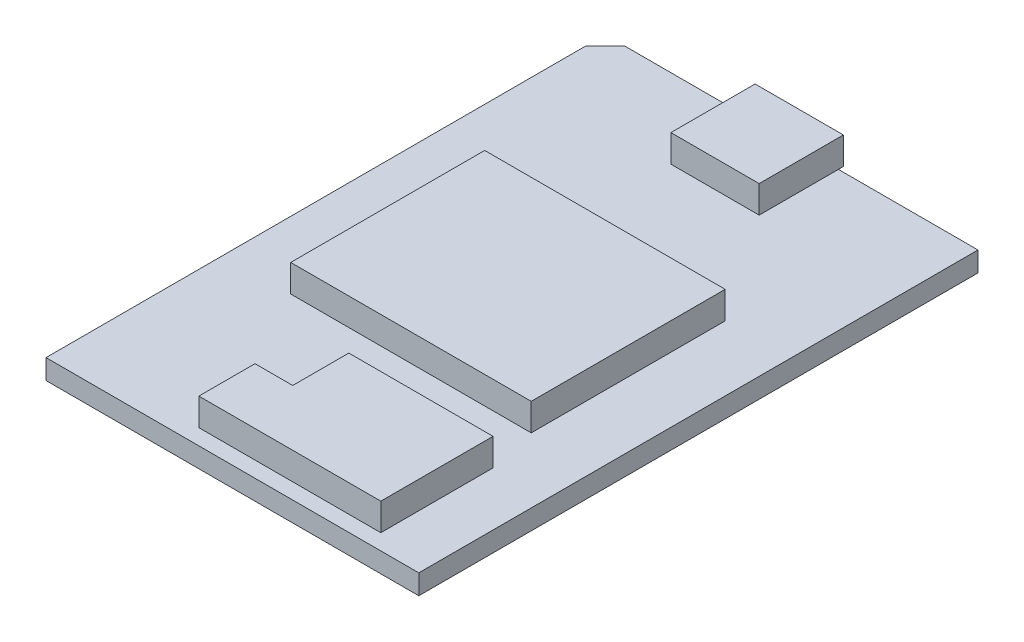
from build123d import *

# Parameters (mm, degrees)
BOSS_EXTRUDE1_DEPTH = 1.6
SKETCH3_W           = 19.355079094
SKETCH3_H           = 15.609116434
BOSS_EXTRUDE2_DEPTH = 2.2
SKETCH4_W           = 7.104895368
SKETCH4_H           = 6.377418
SKETCH4_H_2         = 0.4
BOSS_EXTRUDE4_DEPTH = 2.2
SKETCH5_W           = 22.566472962
SKETCH5_H           = 12.815854083
BOSS_EXTRUDE5_DEPTH = 1.4
SKETCH6_W           = 1.734301273
SKETCH6_H           = 2.066889472
SKETCH6_H_2         = 2.110641646
SKETCH6_W_2         = 1.994894676
SKETCH6_H_3         = 2.153908206
BOSS_EXTRUDE6_DEPTH = 1.4
SKETCH7_W           = 11.606028653
SKETCH7_H           = 9.032244077
SKETCH7_W_2         = 3.035472579
SKETCH7_H_2         = 4.516122038
BOSS_EXTRUDE7_DEPTH = 2.2


with BuildPart() as part:
    # Sketch2 → Boss-Extrude1 (new body)
    with BuildSketch(Plane(origin=(0, 0, 0), x_dir=(1, 0, 0), z_dir=(0, 1, 0))):
        Polygon((1.6, 45), (0, 43.4), (0, 0), (30, 0), (30, 45), align=None)
    extrude(amount=BOSS_EXTRUDE1_DEPTH)

    # Sketch3 → Boss-Extrude2 (add)
    with BuildSketch(Plane(origin=(0, 1.6, 0), x_dir=(1, 0, 0), z_dir=(0, 1, 0))):
        with Locations((15.091884819, 22.082133677)):
            Rectangle(SKETCH3_W, SKETCH3_H)
    extrude(amount=BOSS_EXTRUDE2_DEPTH)

    # Sketch4 → Boss-Extrude4 (add)
    with BuildSketch(Plane(origin=(0, 1.6, 0), x_dir=(1, 0, 0), z_dir=(0, 1, 0))):
        with Locations((15.215017688, 41.811291)):
            Rectangle(SKETCH4_W, SKETCH4_H)
        with Locations((15.215017688, 45.2)):
            Rectangle(SKETCH4_W, SKETCH4_H_2)
    extrude(amount=BOSS_EXTRUDE4_DEPTH)

    # Sketch5 → Boss-Extrude5 (add)
    with BuildSketch(Plane(origin=(0, 0, 0), x_dir=(-1, 0, 0), z_dir=(0, -1, 0))):
        with Locations((-15.528488828, 15.010487551)):
            Rectangle(SKETCH5_W, SKETCH5_H)
    extrude(amount=BOSS_EXTRUDE5_DEPTH)

    # Sketch6 → Boss-Extrude6 (add)
    with BuildSketch(Plane(origin=(0, 0, 0), x_dir=(-1, 0, 0), z_dir=(0, -1, 0))):
        with Locations((-25.936328658, 37.693998436)):
            Rectangle(SKETCH6_W, SKETCH6_H)
        with Locations((-25.936328658, 33.41406102)):
            Rectangle(SKETCH6_W, SKETCH6_H_2)
        with Locations((-26.557976159, 28.546467775)):
            Rectangle(SKETCH6_W_2, SKETCH6_H_3)
    extrude(amount=BOSS_EXTRUDE6_DEPTH)

    # Sketch7 → Boss-Extrude7 (add)
    with BuildSketch(Plane(origin=(0, 1.6, 0), x_dir=(1, 0, 0), z_dir=(0, 1, 0))):
        with Locations((19.872075949, 5.78373458)):
            Rectangle(SKETCH7_W, SKETCH7_H)
        with Locations((12.551325333, 3.52567356)):
            Rectangle(SKETCH7_W_2, SKETCH7_H_2)
    extrude(amount=BOSS_EXTRUDE7_DEPTH)


solid = part.part
